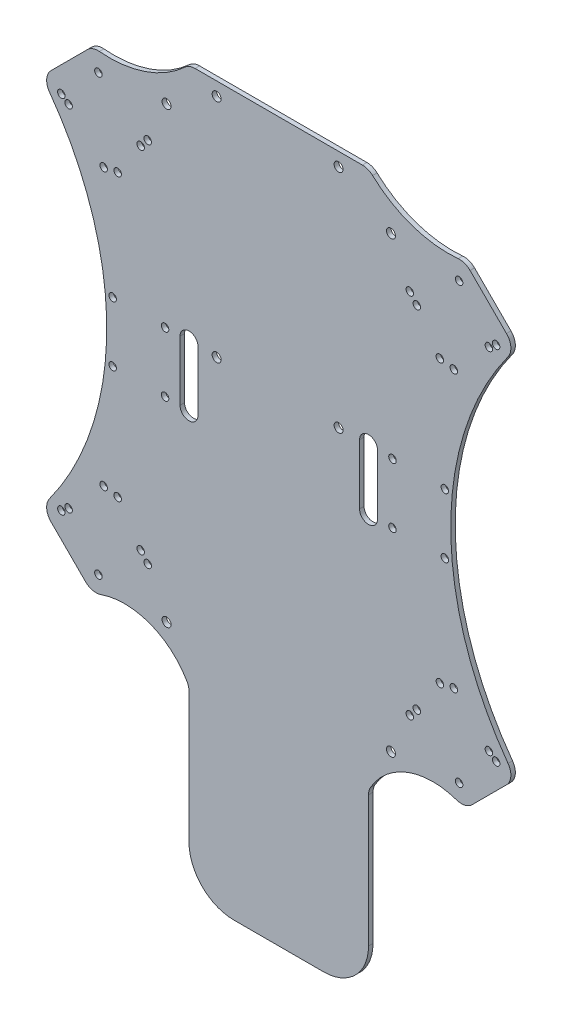
from build123d import *

# Parameters (mm, degrees)
SKETCH2_R           = 1.5
SKETCH2_R_2         = 1.25
BOSS_EXTRUDE1_DEPTH = 1.5
SKETCH3_R           = 1.25
F_45_DEGREES_DEPTH  = 170.629743854
SKETCH4_R           = 1.5
ODROID_HOLES_DEPTH  = 170.629743854
FILLET1_R           = 5
FILLET2_R           = 5
FILLET3_R           = 5
FILLET4_R           = 5
FILLET5_R           = 5
FILLET6_R           = 5
FILLET7_R           = 5
FILLET8_R           = 5
FILLET9_R           = 5
FILLET10_R          = 5
FILLET11_R          = 5
FILLET12_R          = 5
SKETCH5_R           = 1.25
F_35_DEGREES_DEPTH  = 169.878448293


with BuildPart() as part:
    # Sketch2 → Boss-Extrude1 (new body)
    with BuildSketch(Plane.XY):
        with BuildLine():
            Line((-79.195959493, 62.225396744), (-62.225396744, 79.195959493))
            ThreePointArc((-62.225396744, 79.195959493), (-44.806778225, 80.702789346), (-30, 90))
            Line((-30, 90), (30, 90))
            ThreePointArc((30, 90), (44.806778225, 80.702789346), (62.225396744, 79.195959493))
            Line((62.225396744, 79.195959493), (79.195959493, 62.225396744))
            ThreePointArc((79.195959493, 62.225396744), (57.477502656, 0), (79.195959493, -62.225396744))
            Line((79.195959493, -62.225396744), (62.225396744, -79.195959493))
            ThreePointArc((62.225396744, -79.195959493), (43.875108319, -77.923881554), (30, -90))
            Line((30, -90), (30, -135))
            ThreePointArc((30, -135), (25.606601718, -145.606601718), (15, -150))
            Line((15, -150), (-15, -150))
            ThreePointArc((-15, -150), (-25.606601718, -145.606601718), (-30, -135))
            Line((-30, -135), (-30, -90))
            ThreePointArc((-30, -90), (-43.875108319, -77.923881554), (-62.225396744, -79.195959493))
            Line((-62.225396744, -79.195959493), (-79.195959493, -62.225396744))
            ThreePointArc((-79.195959493, -62.225396744), (-57.477502656, 0), (-79.195959493, 62.225396744))
        make_face()
        with Locations((-37.5, 75)):
            Circle(SKETCH2_R, mode=Mode.SUBTRACT)
        with Locations((37.5, 75)):
            Circle(SKETCH2_R, mode=Mode.SUBTRACT)
        with Locations((37.5, -75)):
            Circle(SKETCH2_R, mode=Mode.SUBTRACT)
        with Locations((-37.5, -75)):
            Circle(SKETCH2_R, mode=Mode.SUBTRACT)
        with Locations((-55.5, 10)):
            Circle(SKETCH2_R_2, mode=Mode.SUBTRACT)
        with Locations((-38, 10)):
            Circle(SKETCH2_R_2, mode=Mode.SUBTRACT)
        with Locations((-55.5, -10)):
            Circle(SKETCH2_R_2, mode=Mode.SUBTRACT)
        with Locations((-38, -10)):
            Circle(SKETCH2_R_2, mode=Mode.SUBTRACT)
        with Locations((55.5, -10)):
            Circle(SKETCH2_R_2, mode=Mode.SUBTRACT)
        with Locations((38, -10)):
            Circle(SKETCH2_R_2, mode=Mode.SUBTRACT)
        with Locations((38, 10)):
            Circle(SKETCH2_R_2, mode=Mode.SUBTRACT)
        with Locations((55.5, 10)):
            Circle(SKETCH2_R_2, mode=Mode.SUBTRACT)
        with BuildLine():
            Line((27, -10), (27, 10))
            ThreePointArc((27, 10), (30, 13), (33, 10))
            Line((33, 10), (33, -10))
            ThreePointArc((33, -10), (30, -13), (27, -10))
        make_face(mode=Mode.SUBTRACT)
        with BuildLine():
            Line((-27, -10), (-27, 10))
            ThreePointArc((-27, 10), (-30, 13), (-33, 10))
            Line((-33, 10), (-33, -10))
            ThreePointArc((-33, -10), (-30, -13), (-27, -10))
        make_face(mode=Mode.SUBTRACT)
    extrude(amount=BOSS_EXTRUDE1_DEPTH)

    # Sketch3 → 45 Degrees (cut, through all)
    with BuildSketch(Plane.XY.offset(1.5)):
        with Locations((-72.655221767, 60.280853096)):
            Circle(SKETCH3_R)
        with Locations((-58.513086143, 46.138717472)):
            Circle(SKETCH3_R)
        with Locations(Location((-60.280853096, 72.655221767, 0), (0, 0, 180))):
            Circle(SKETCH3_R)
        with Locations(Location((-46.138717472, 58.513086143, 0), (0, 0, 180))):
            Circle(SKETCH3_R)
        with Locations(Location((58.513086143, 46.138717472, 0), (0, 0, 180))):
            Circle(SKETCH3_R)
        with Locations(Location((72.655221767, 60.280853096, 0), (0, 0, 180))):
            Circle(SKETCH3_R)
        with Locations((60.280853096, 72.655221767)):
            Circle(SKETCH3_R)
        with Locations((46.138717472, 58.513086143)):
            Circle(SKETCH3_R)
        with Locations(Location((-58.513086143, -46.138717472, 0), (0, 0, 180))):
            Circle(SKETCH3_R)
        with Locations((-46.138717472, -58.513086143)):
            Circle(SKETCH3_R)
        with Locations((-60.280853096, -72.655221767)):
            Circle(SKETCH3_R)
        with Locations(Location((-72.655221767, -60.280853096, 0), (0, 0, 180))):
            Circle(SKETCH3_R)
        with Locations((58.513086143, -46.138717472)):
            Circle(SKETCH3_R)
        with Locations((72.655221767, -60.280853096)):
            Circle(SKETCH3_R)
        with Locations(Location((60.280853096, -72.655221767, 0), (0, 0, 180))):
            Circle(SKETCH3_R)
        with Locations(Location((46.138717472, -58.513086143, 0), (0, 0, 180))):
            Circle(SKETCH3_R)
    extrude(amount=-F_45_DEGREES_DEPTH, mode=Mode.SUBTRACT)

    # Sketch4 → ODroid holes (cut, through all)
    with BuildSketch(Plane.XY.offset(1.5)):
        with Locations((-20.76, 10)):
            Circle(SKETCH4_R)
        with Locations((20, 10)):
            Circle(SKETCH4_R)
        with Locations((-20.76, 85.5)):
            Circle(SKETCH4_R)
        with Locations((20, 85.5)):
            Circle(SKETCH4_R)
    extrude(amount=-ODROID_HOLES_DEPTH, mode=Mode.SUBTRACT)

    # Fillet1
    fillet1_edges = [part.edges().sort_by_distance(p)[0] for p in [
        (-30, -90, 0.75),
    ]]
    fillet(fillet1_edges, radius=FILLET1_R)

    # Fillet2
    fillet2_edges = [part.edges().sort_by_distance(p)[0] for p in [
        (-62.225396744, -79.195959493, 0.75),
    ]]
    fillet(fillet2_edges, radius=FILLET2_R)

    # Fillet3
    fillet3_edges = [part.edges().sort_by_distance(p)[0] for p in [
        (30, -90, 0.75),
    ]]
    fillet(fillet3_edges, radius=FILLET3_R)

    # Fillet4
    fillet4_edges = [part.edges().sort_by_distance(p)[0] for p in [
        (62.225396744, -79.195959493, 0.75),
    ]]
    fillet(fillet4_edges, radius=FILLET4_R)

    # Fillet5
    fillet5_edges = [part.edges().sort_by_distance(p)[0] for p in [
        (79.195959493, -62.225396744, 0.75),
    ]]
    fillet(fillet5_edges, radius=FILLET5_R)

    # Fillet6
    fillet6_edges = [part.edges().sort_by_distance(p)[0] for p in [
        (-79.195959493, -62.225396744, 0.75),
    ]]
    fillet(fillet6_edges, radius=FILLET6_R)

    # Fillet7
    fillet7_edges = [part.edges().sort_by_distance(p)[0] for p in [
        (-79.195959493, 62.225396744, 0.75),
    ]]
    fillet(fillet7_edges, radius=FILLET7_R)

    # Fillet8
    fillet8_edges = [part.edges().sort_by_distance(p)[0] for p in [
        (-62.225396744, 79.195959493, 0.75),
    ]]
    fillet(fillet8_edges, radius=FILLET8_R)

    # Fillet9
    fillet9_edges = [part.edges().sort_by_distance(p)[0] for p in [
        (-30, 90, 0.75),
    ]]
    fillet(fillet9_edges, radius=FILLET9_R)

    # Fillet10
    fillet10_edges = [part.edges().sort_by_distance(p)[0] for p in [
        (30, 90, 0.75),
    ]]
    fillet(fillet10_edges, radius=FILLET10_R)

    # Fillet11
    fillet11_edges = [part.edges().sort_by_distance(p)[0] for p in [
        (62.225396744, 79.195959493, 0.75),
    ]]
    fillet(fillet11_edges, radius=FILLET11_R)

    # Fillet12
    fillet12_edges = [part.edges().sort_by_distance(p)[0] for p in [
        (79.195959493, 62.225396744, 0.75),
    ]]
    fillet(fillet12_edges, radius=FILLET12_R)

    # Sketch5 → 35 Degrees (cut, through all)
    with BuildSketch(Plane.XY.offset(1.5)):
        with Locations(Location((-60.280853096, 72.655221767, 0), (0, 0, 180))):
            Circle(SKETCH5_R)
        with Locations((-70.218840229, 58.462305252)):
            Circle(SKETCH5_R)
        with Locations((-53.835799344, 46.990776525)):
            Circle(SKETCH5_R)
        with Locations((-43.79882923, 61.326369694)):
            Circle(SKETCH5_R)
        with Locations((60.280853096, 72.655221767)):
            Circle(SKETCH5_R)
        with Locations(Location((43.79882923, 61.326369694, 0), (0, 0, 180))):
            Circle(SKETCH5_R)
        with Locations(Location((53.835799344, 46.990776525, 0), (0, 0, 180))):
            Circle(SKETCH5_R)
        with Locations(Location((70.218840229, 58.462305252, 0), (0, 0, 180))):
            Circle(SKETCH5_R)
        with Locations(Location((-70.218840229, -58.462305252, 0), (0, 0, 180))):
            Circle(SKETCH5_R)
        with Locations((-60.280853096, -72.655221767)):
            Circle(SKETCH5_R)
        with Locations(Location((-53.835799344, -46.990776525, 0), (0, 0, 180))):
            Circle(SKETCH5_R)
        with Locations(Location((-43.79882923, -61.326369694, 0), (0, 0, 180))):
            Circle(SKETCH5_R)
        with Locations((70.218840229, -58.462305252)):
            Circle(SKETCH5_R)
        with Locations(Location((60.280853096, -72.655221767, 0), (0, 0, 180))):
            Circle(SKETCH5_R)
        with Locations((43.79882923, -61.326369694)):
            Circle(SKETCH5_R)
        with Locations((53.835799344, -46.990776525)):
            Circle(SKETCH5_R)
    extrude(amount=-F_35_DEGREES_DEPTH, mode=Mode.SUBTRACT)


solid = part.part
